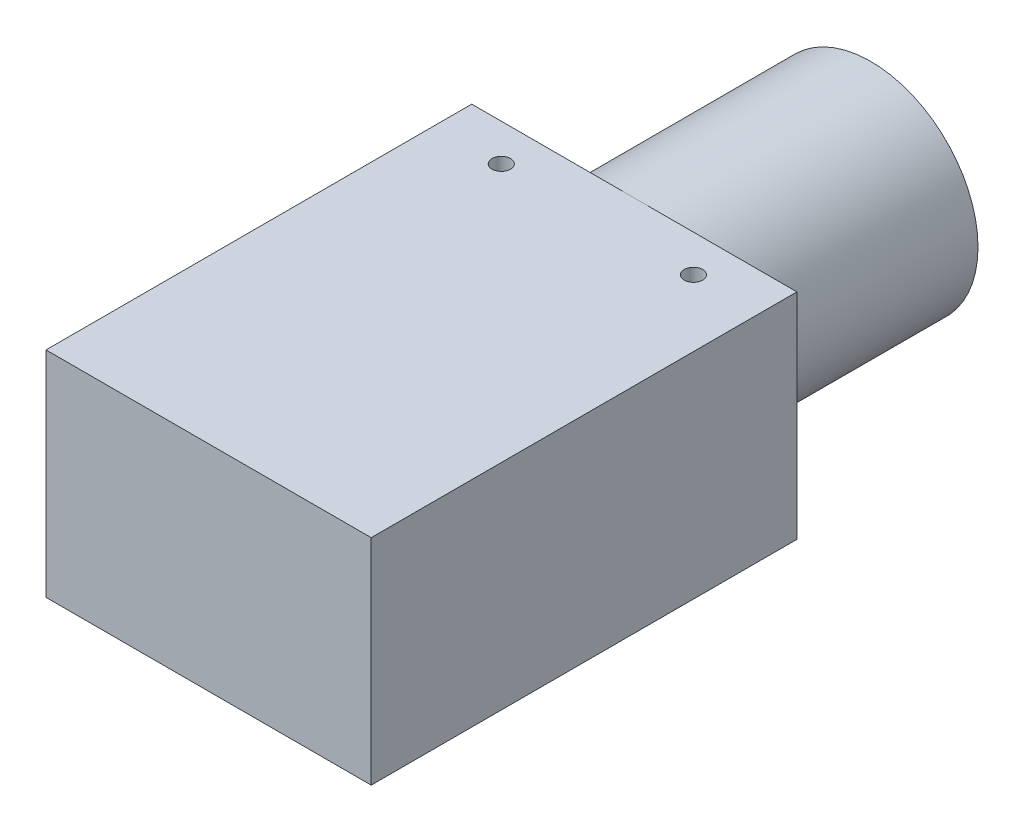
from build123d import *

# Parameters (mm, degrees)
SKETCH1_W                 = 44
SKETCH1_H                 = 29
BOSS_EXTRUDE1_DEPTH       = 57.6
SKETCH2_R                 = 14.5
BOSS_EXTRUDE2_DEPTH       = 32
M3X0_5_TAPPED_HOLE1_D     = 2.5
M3X0_5_TAPPED_HOLE1_DEPTH = 3
M3X0_5_TAPPED_HOLE1_TIP   = 0.751075774


with BuildPart() as part:
    # Sketch1 → Boss-Extrude1 (new body)
    with BuildSketch(Plane.XY):
        Rectangle(SKETCH1_W, SKETCH1_H)
    extrude(amount=BOSS_EXTRUDE1_DEPTH)

    # Sketch2 → Boss-Extrude2 (add)
    with BuildSketch(Plane.XY):
        Circle(SKETCH2_R)
    extrude(amount=-BOSS_EXTRUDE2_DEPTH)

    # M3x0.5 Tapped Hole1
    with Locations(Plane(origin=(0, 14.5, 0), x_dir=(1, 0, 0), z_dir=(0, 1, 0))):
        with Locations((-13, -5), (13, -5)):
            Hole(M3X0_5_TAPPED_HOLE1_D / 2, depth=M3X0_5_TAPPED_HOLE1_DEPTH)
            with Locations((0, 0, -(M3X0_5_TAPPED_HOLE1_DEPTH + M3X0_5_TAPPED_HOLE1_TIP / 2))):  # 118° drill point
                Cone(0, M3X0_5_TAPPED_HOLE1_D / 2, M3X0_5_TAPPED_HOLE1_TIP, mode=Mode.SUBTRACT)


solid = part.part
